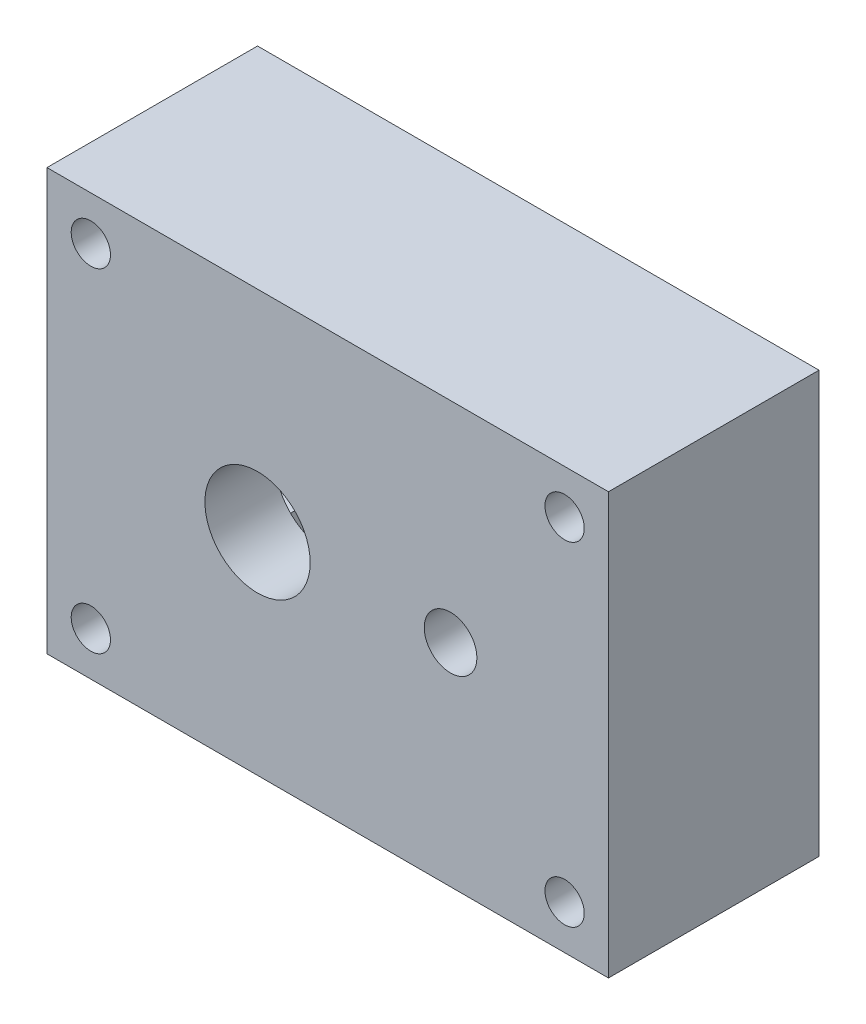
from build123d import *

# Parameters (mm, degrees)
SKETCH1_W           = 50.8
SKETCH1_H           = 38.1
BOSS_EXTRUDE1_DEPTH = 19.05
SKETCH2_W           = 44.45
SKETCH2_H           = 31.75
CUT_EXTRUDE1_DEPTH  = 12.7
SKETCH3_R           = 4.7625
SKETCH3_R_2         = 2.38125
CUT_EXTRUDE2_DEPTH  = 42.639734629
SKETCH4_W           = 7.9375
SKETCH4_H           = 7.9375
BOSS_EXTRUDE2_DEPTH = 12.7
SKETCH5_R           = 1.778
CUT_EXTRUDE3_DEPTH  = 42.639734629


with BuildPart() as part:
    # Sketch1 → Boss-Extrude1 (new body)
    with BuildSketch(Plane.XY):
        with Locations((6.35, 0)):
            Rectangle(SKETCH1_W, SKETCH1_H)
    extrude(amount=-BOSS_EXTRUDE1_DEPTH)

    # Sketch2 → Cut-Extrude1 (cut)
    with BuildSketch(Plane(origin=(0, 0, -19.05), x_dir=(-1, 0, 0), z_dir=(0, 0, -1))):
        with Locations((-6.35, 0)):
            Rectangle(SKETCH2_W, SKETCH2_H)
    extrude(amount=-CUT_EXTRUDE1_DEPTH, mode=Mode.SUBTRACT)

    # Sketch3 → Cut-Extrude2 (cut, through all)
    with BuildSketch(Plane.XY):
        Circle(SKETCH3_R)
        with Locations((17.462302917, 0.082964446)):
            Circle(SKETCH3_R_2)
    extrude(amount=-CUT_EXTRUDE2_DEPTH, mode=Mode.SUBTRACT)

    # Sketch4 → Boss-Extrude2 (add)
    with BuildSketch(Plane(origin=(0, 0, -6.35), x_dir=(-1, 0, 0), z_dir=(0, 0, -1))):
        with Locations((-27.78125, 15.08125)):
            Rectangle(SKETCH4_W, SKETCH4_H)
        with Locations((15.08125, 15.08125)):
            Rectangle(SKETCH4_W, SKETCH4_H)
        with Locations((15.08125, -15.08125)):
            Rectangle(SKETCH4_W, SKETCH4_H)
        with Locations((-27.78125, -15.08125)):
            Rectangle(SKETCH4_W, SKETCH4_H)
    extrude(amount=BOSS_EXTRUDE2_DEPTH)

    # Sketch5 → Cut-Extrude3 (cut, through all)
    with BuildSketch(Plane(origin=(0, 0, -19.05), x_dir=(-1, 0, 0), z_dir=(0, 0, -1))):
        with Locations((-27.78125, 15.08125)):
            Circle(SKETCH5_R)
        with Locations((15.08125, 15.08125)):
            Circle(SKETCH5_R)
        with Locations((15.08125, -15.08125)):
            Circle(SKETCH5_R)
        with Locations((-27.78125, -15.08125)):
            Circle(SKETCH5_R)
    extrude(amount=-CUT_EXTRUDE3_DEPTH, mode=Mode.SUBTRACT)


solid = part.part
